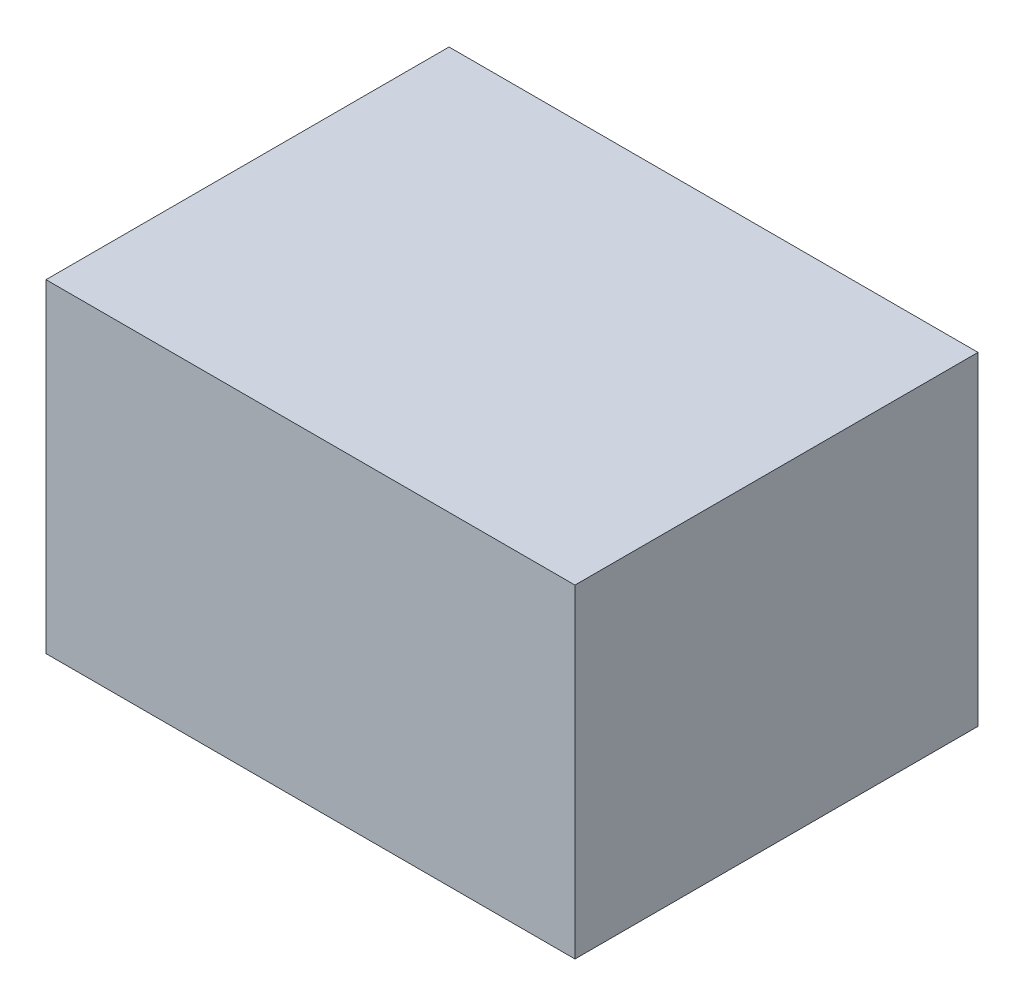
from build123d import *

# Parameters (mm, degrees)
SKETCH1_W           = 373.38
SKETCH1_H           = 284.48
BOSS_EXTRUDE1_DEPTH = 114.3


with BuildPart() as part:
    # Sketch1 → Boss-Extrude1 (new, symmetric)
    with BuildSketch(Plane(origin=(0, 0, 0), x_dir=(1, 0, 0), z_dir=(0, 1, 0))):
        Rectangle(SKETCH1_W, SKETCH1_H)
    extrude(amount=BOSS_EXTRUDE1_DEPTH, both=True)


solid = part.part
